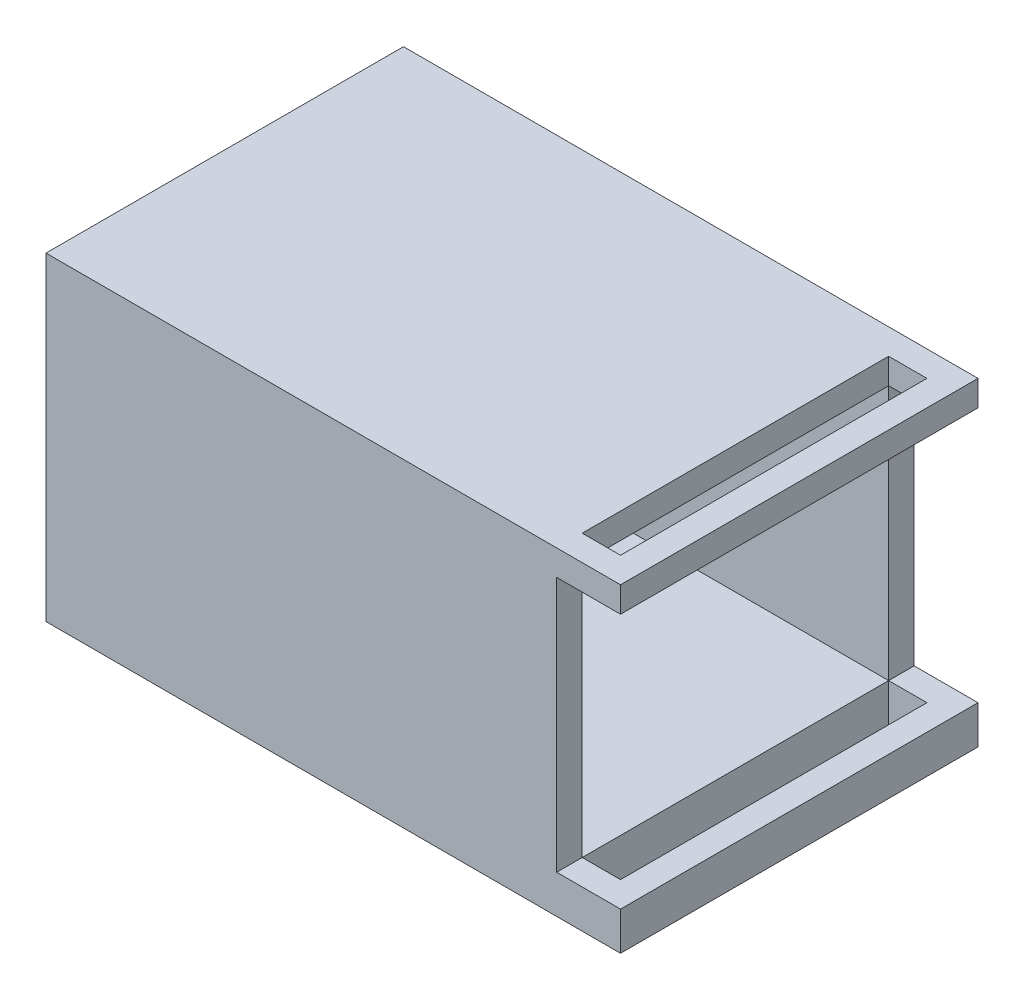
from build123d import *

# Parameters (mm, degrees)
SKETCH1_W           = 45
SKETCH1_H           = 28
BOSS_EXTRUDE1_DEPTH = 3
BOSS_EXTRUDE2_DEPTH = 22
SKETCH4_W           = 45
SKETCH4_H           = 28
SKETCH4_W_2         = 3
SKETCH4_H_2         = 24
BOSS_EXTRUDE4_DEPTH = 2
SKETCH5_W           = 9
SKETCH5_H           = 4
CUT_EXTRUDE1_DEPTH  = 2
SKETCH6_W           = 3
SKETCH6_H           = 24
CUT_EXTRUDE2_DEPTH  = 3


with BuildPart() as part:
    # Sketch1 → Boss-Extrude1 (new body)
    with BuildSketch(Plane(origin=(0, 0, 0), x_dir=(1, 0, 0), z_dir=(0, 1, 0))):
        with Locations((22.5, 14)):
            Rectangle(SKETCH1_W, SKETCH1_H)
    extrude(amount=BOSS_EXTRUDE1_DEPTH)

    # Sketch2 → Boss-Extrude2 (add)
    with BuildSketch(Plane(origin=(0, 3, 0), x_dir=(1, 0, 0), z_dir=(0, 1, 0))):
        Polygon((40, 26), (40, 28), (0, 28), (0, 0), (40, 0), (40, 2), (2, 2), (2, 26), align=None)
    extrude(amount=BOSS_EXTRUDE2_DEPTH)

    # Sketch4 → Boss-Extrude4 (add)
    with BuildSketch(Plane(origin=(0, 25, 0), x_dir=(1, 0, 0), z_dir=(0, 1, 0))):
        with Locations((22.5, 14)):
            Rectangle(SKETCH4_W, SKETCH4_H)
        with Locations((41.5, 14)):
            Rectangle(SKETCH4_W_2, SKETCH4_H_2, mode=Mode.SUBTRACT)
    extrude(amount=-BOSS_EXTRUDE4_DEPTH)

    # Sketch5 → Cut-Extrude1 (cut)
    with BuildSketch(Plane.ZY):
        with BuildLine():
            Line((-18.72, 5.25), (-18.72, 5.96))
            ThreePointArc((-18.72, 5.96), (-18.353883476, 6.843883476), (-17.47, 7.21))
            Line((-17.47, 7.21), (-10.53, 7.21))
            ThreePointArc((-10.53, 7.21), (-9.646116524, 6.843883476), (-9.28, 5.96))
            Line((-9.28, 5.96), (-9.28, 5.25))
            ThreePointArc((-9.28, 5.25), (-9.646116524, 4.366116524), (-10.53, 4))
            Line((-10.53, 4), (-17.47, 4))
            ThreePointArc((-17.47, 4), (-18.353883476, 4.366116524), (-18.72, 5.25))
        make_face()
        with Locations((-14, 10.5)):
            Rectangle(SKETCH5_W, SKETCH5_H)
    extrude(amount=-CUT_EXTRUDE1_DEPTH, mode=Mode.SUBTRACT)

    # Sketch6 → Cut-Extrude2 (cut)
    with BuildSketch(Plane(origin=(0, 3, 0), x_dir=(1, 0, 0), z_dir=(0, 1, 0))):
        with Locations((41.5, 14)):
            Rectangle(SKETCH6_W, SKETCH6_H)
    extrude(amount=-CUT_EXTRUDE2_DEPTH, mode=Mode.SUBTRACT)


solid = part.part
